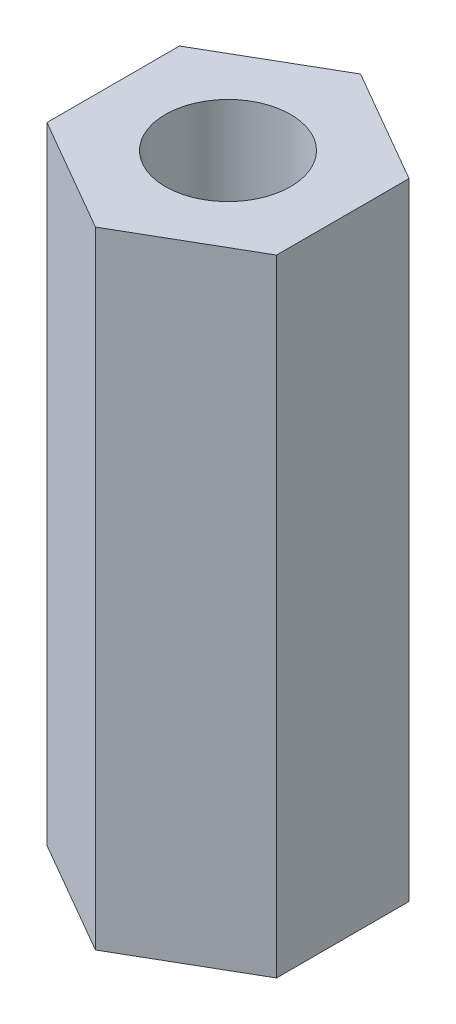
from build123d import *

# Parameters (mm, degrees)
SKETCH1_R           = 1.5
BOSS_EXTRUDE1_DEPTH = 7.5


with BuildPart() as part:
    # Sketch1 → Boss-Extrude1 (new, symmetric)
    with BuildSketch(Plane(origin=(0, 0, 0), x_dir=(1, 0, 0), z_dir=(0, 1, 0))):
        Polygon((0, -3.175426481), (2.75, -1.58771324), (2.75, 1.58771324), (0, 3.175426481), (-2.75, 1.58771324), (-2.75, -1.58771324), align=None)
        with Locations(Location((0, 0, 0), (0, 0, 270))):
            Circle(SKETCH1_R, mode=Mode.SUBTRACT)
    extrude(amount=BOSS_EXTRUDE1_DEPTH, both=True)


solid = part.part
